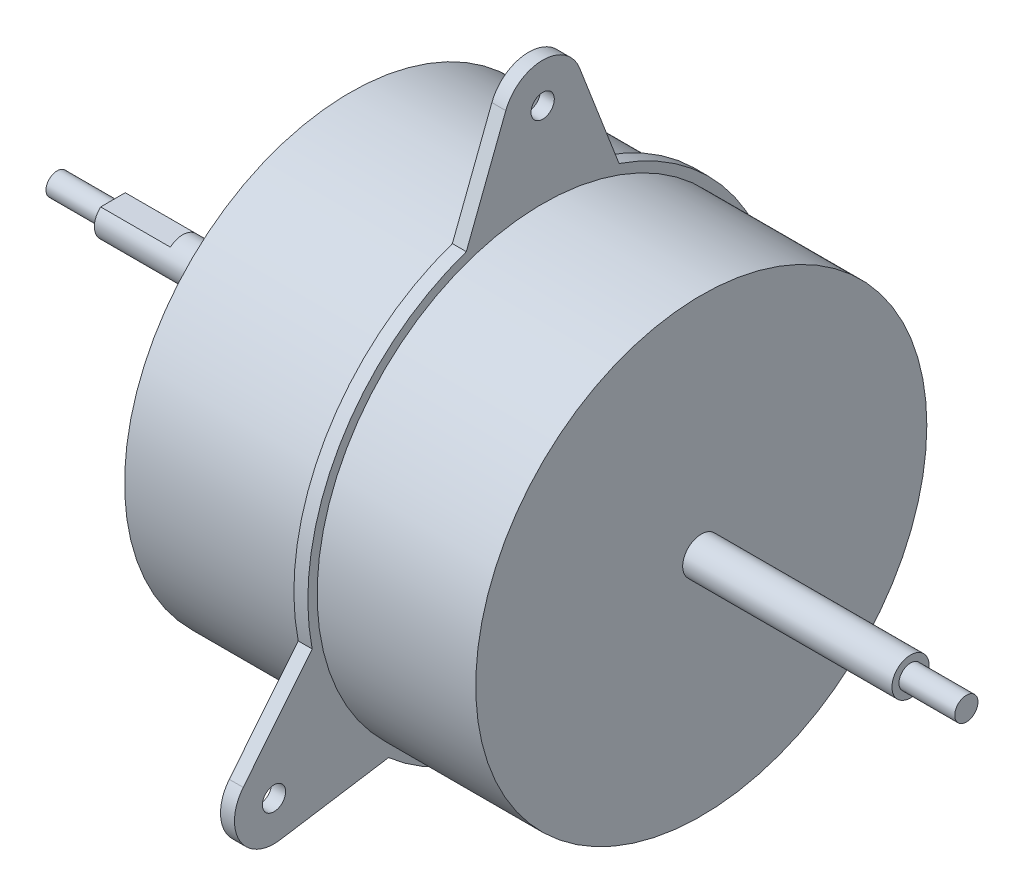
from build123d import *

# Parameters (mm, degrees)
SKETCH2_R           = 2.5
BOSS_EXTRUDE1_DEPTH = 3
CUT_EXTRUDE1_START  = -15
CUT_EXTRUDE1_DEPTH  = 15


with BuildPart() as part:
    # Sketch1 → Revolve1 (revolve)
    with BuildSketch(Plane.XY, mode=Mode.PRIVATE) as revolve1_sk:
        Polygon((0, 48.5), (37.1, 48.5), (37.1, 4), (82.1, 4), (82.1, 2.5), (94.1, 2.5), (94.1, 0), (-101.4, 0), (-101.4, 2.4), (-89.4, 2.4), (-89.4, 4), (-38.4, 4), (-38.4, 48.5), align=None)
    revolve(revolve1_sk.sketch.rotate(Axis((0, 0, 0), (-1, 0, 0)), 90), axis=Axis((0, 0, 0), (-1, 0, 0)))

    # Sketch2 → Boss-Extrude1 (add)
    with BuildSketch(Plane(origin=(0, 0, 0), x_dir=(0, 0, -1), z_dir=(1, 0, 0))):
        with BuildLine():
            Line((-7.930604102, 69.771502825), (-16.421800454, 47.75536064))
            ThreePointArc((-16.421800454, 47.75536064), (-43.734282891, 25.25), (-49.568255708, -9.655983951))
            Line((-49.568255708, -9.655983951), (-64.389195958, -28.017646793))
            ThreePointArc((-64.389195958, -28.017646793), (-65.136215932, -37.606411802), (-56.458591856, -41.753856033))
            Line((-56.458591856, -41.753856033), (-33.146455254, -38.099376689))
            ThreePointArc((-33.146455254, -38.099376689), (0, -50.5), (33.146455254, -38.099376689))
            Line((33.146455254, -38.099376689), (56.458591856, -41.753856033))
            ThreePointArc((56.458591856, -41.753856033), (65.136215932, -37.606411802), (64.389195958, -28.017646793))
            Line((64.389195958, -28.017646793), (49.568255708, -9.655983951))
            ThreePointArc((49.568255708, -9.655983951), (43.734282891, 25.25), (16.421800454, 47.75536064))
            Line((16.421800454, 47.75536064), (7.930604102, 69.771502825))
            ThreePointArc((7.930604102, 69.771502825), (0, 75.212823605), (-7.930604102, 69.771502825))
        make_face()
        with Locations((0, 66.712823605)):
            Circle(SKETCH2_R, mode=Mode.SUBTRACT)
        with Locations((57.775, -33.356411802)):
            Circle(SKETCH2_R, mode=Mode.SUBTRACT)
        with Locations((-57.775, -33.356411802)):
            Circle(SKETCH2_R, mode=Mode.SUBTRACT)
    extrude(amount=BOSS_EXTRUDE1_DEPTH)

    # Sketch4 → Cut-Extrude1 (cut)
    with BuildSketch(Plane.ZY.offset(89.4).offset(CUT_EXTRUDE1_START)):
        with BuildLine():
            Line((-2.645751311, 3), (2.645751311, 3))
            ThreePointArc((2.645751311, 3), (0, 4), (-2.645751311, 3))
        make_face()
    extrude(amount=CUT_EXTRUDE1_DEPTH, mode=Mode.SUBTRACT)


solid = part.part
